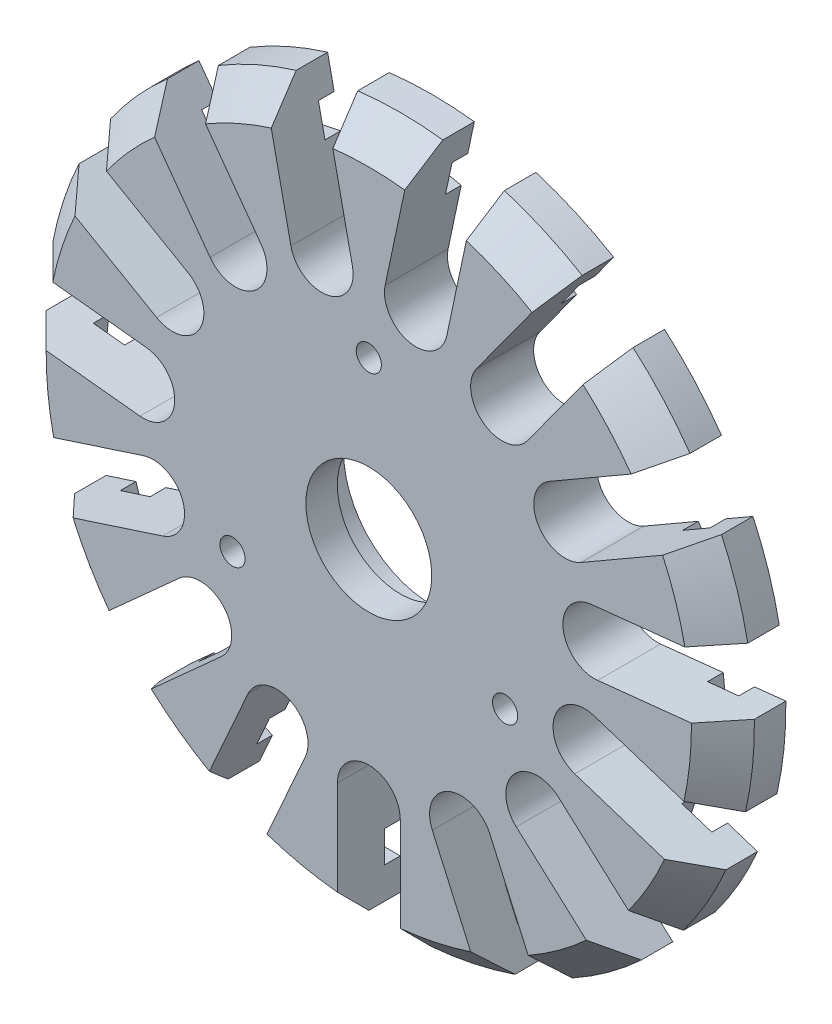
from build123d import *

# Parameters (mm, degrees)
ESBO_O1_R                               = 22.5
RESSALTO_EXTRUS_O1_DEPTH                = 4
CHANFRO1_SIZE                           = 2
CORTE_EXTRUS_O1_DEPTH                   = 33.070235422
ESBO_O3_R                               = 4
CORTE_EXTRUS_O2_DEPTH                   = 33.070235422
ESBO_O4_R                               = 5.6
CORTE_EXTRUS_O3_DEPTH                   = 2
PADR_OCIRCULAR1_COUNT                   = 15
ESBO_O11_W                              = 7
ESBO_O11_H                              = 2
CORTE_EXTRUS_O4_DEPTH                   = 1
PADR_OCIRCULAR3_COUNT                   = 15
BROCA_DE_ROSQUEAR_PARA_TARRAXA_DE_M21_D = 1.6
PADR_OCIRCULAR4_COUNT                   = 3


with BuildPart() as part:
    # Esboço1 → Ressalto-extrusão1 (new body)
    with BuildSketch(Plane.XY):
        Circle(ESBO_O1_R)
    extrude(amount=RESSALTO_EXTRUS_O1_DEPTH)

    # Chanfro1
    chanfro1_edges = [part.edges().sort_by_distance(p)[0] for p in [
        (-22.5, 0, 4),
    ]]
    chamfer(chanfro1_edges, length=CHANFRO1_SIZE)

    # Esboço2 → Corte-extrusão1 (cut, through all)
    with BuildSketch(Plane(origin=(0, 0, 0), x_dir=(-1, 0, 0), z_dir=(0, 0, -1))):
        with BuildLine():
            Line((2, -22.410934831), (2, -14.410934831))
            ThreePointArc((2, -14.410934831), (0, -12.410934831), (-2, -14.410934831))
            Line((-2, -14.410934831), (-2, -22.410934831))
            ThreePointArc((-2, -22.410934831), (0, -22.5), (2, -22.410934831))
        make_face()
    corte_extrus_o1 = extrude(amount=-CORTE_EXTRUS_O1_DEPTH, mode=Mode.SUBTRACT)

    # Esboço3 → Corte-extrusão2 (cut, through all)
    with BuildSketch(Plane(origin=(0, 0, 0), x_dir=(-1, 0, 0), z_dir=(0, 0, -1))):
        Circle(ESBO_O3_R)
    extrude(amount=-CORTE_EXTRUS_O2_DEPTH, mode=Mode.SUBTRACT)

    # Esboço4 → Corte-extrusão3 (cut)
    with BuildSketch(Plane(origin=(0, 0, 0), x_dir=(-1, 0, 0), z_dir=(0, 0, -1))):
        Circle(ESBO_O4_R)
    extrude(amount=-CORTE_EXTRUS_O3_DEPTH, mode=Mode.SUBTRACT)

    # PadrãoCircular1: Corte-extrusão1 ×15 about axis
    padr_ocircular1_axis = Axis((0, 0, 0), (0, 0, 1))
    for i in range(1, PADR_OCIRCULAR1_COUNT):
        add(corte_extrus_o1.rotate(padr_ocircular1_axis, i * 360 / PADR_OCIRCULAR1_COUNT), mode=Mode.SUBTRACT)

    # Esboço11 → Corte-extrusão4 (cut)
    with BuildSketch(Plane(origin=(0, 0, 0), x_dir=(-1, 0, 0), z_dir=(0, 0, -1))):
        with Locations((0, -19.410934831)):
            Rectangle(ESBO_O11_W, ESBO_O11_H)
    corte_extrus_o4 = extrude(amount=-CORTE_EXTRUS_O4_DEPTH, mode=Mode.SUBTRACT)

    # PadrãoCircular3: Corte-extrusão4 ×15 about axis
    padr_ocircular3_axis = Axis((0, 0, 0), (0, 0, 1))
    for i in range(1, PADR_OCIRCULAR3_COUNT):
        add(corte_extrus_o4.rotate(padr_ocircular3_axis, i * 360 / PADR_OCIRCULAR3_COUNT), mode=Mode.SUBTRACT)

    # Broca de rosquear para tarraxa de M21 (through all)
    with Locations(Plane(origin=(0, 10, 0), x_dir=(-1, 0, 0), z_dir=(0, 0, -1))):
        with Locations((0, 0)):
            broca_de_rosquear_para_tarraxa_de_m21 = Hole(BROCA_DE_ROSQUEAR_PARA_TARRAXA_DE_M21_D / 2)

    # PadrãoCircular4: Broca de rosquear para tarraxa de M21 ×3 about axis
    padr_ocircular4_axis = Axis((0, 0, 0), (0, 0, 1))
    for i in range(1, PADR_OCIRCULAR4_COUNT):
        add(broca_de_rosquear_para_tarraxa_de_m21.rotate(padr_ocircular4_axis, i * 360 / PADR_OCIRCULAR4_COUNT), mode=Mode.SUBTRACT)


solid = part.part
